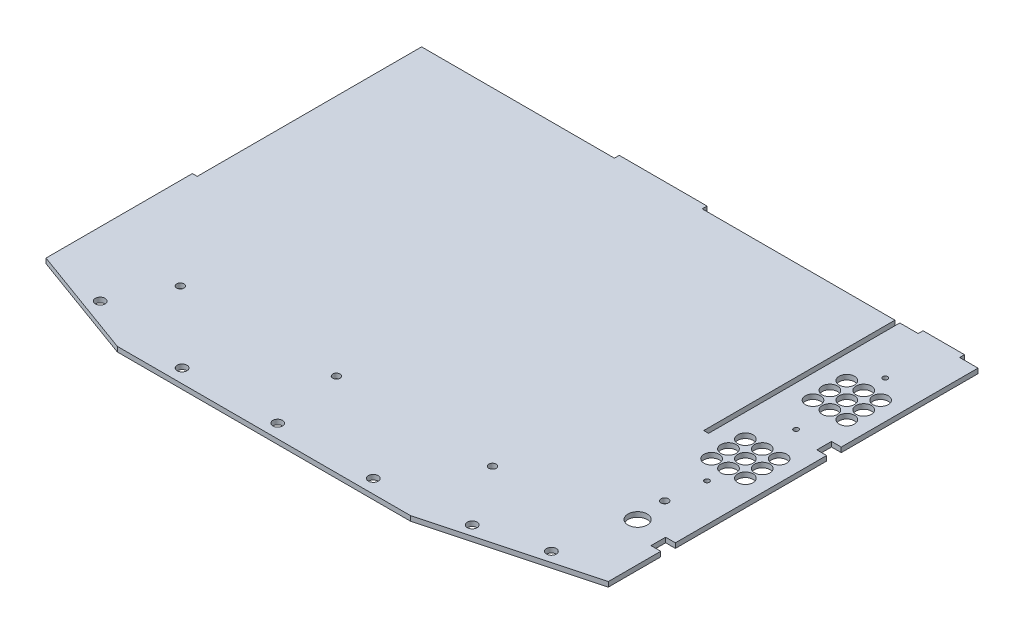
from build123d import *

# Parameters (mm, degrees)
SKETCH1_W            = 308.08168
SKETCH1_H            = 3.175
BOSS_EXTRUDE1_DEPTH  = 267.83
SKETCH3_W            = 267.83
SKETCH3_H            = 3.175
BOSS_EXTRUDE3_DEPTH  = 3.175
SKETCH4_W            = 50.8889
SKETCH4_H            = 3.175
BOSS_EXTRUDE4_DEPTH  = 267.83
CUT_EXTRUDE1_DEPTH   = 340.191055801
SKETCH17_W           = 267.83
SKETCH17_H           = 3.175
BOSS_EXTRUDE5_DEPTH  = 3.175
CUT_EXTRUDE3_DEPTH   = 340.191055801
SKETCH25_R           = 3.175
CUT_EXTRUDE8_DEPTH   = 3.175
SKETCH27_R           = 5
CUT_EXTRUDE9_DEPTH   = 340.191055801
SKETCH31_R           = 1.5875
CUT_EXTRUDE10_DEPTH  = 340.191055801
LPATTERN1_COUNT      = 3
LPATTERN1_PITCH      = 58
M4_CLEARANCE_HOLE1_D = 4.8
SKETCH36_W           = 57.15
SKETCH36_H           = 3.175
SKETCH36_W_2         = 26.9875
BOSS_EXTRUDE6_DEPTH  = 3.175
SKETCH37_W           = 3.175
SKETCH37_H           = 124.4419914
CUT_EXTRUDE11_DEPTH  = 340.191055801
SKETCH38_W           = 3.175
SKETCH38_H           = 146.0243
CUT_EXTRUDE12_DEPTH  = 340.191055801
SKETCH39_W           = 6.35
SKETCH39_H           = 9.525
CUT_EXTRUDE13_DEPTH  = 340.191055801
SKETCH40_R           = 6.25
CUT_EXTRUDE14_DEPTH  = 340.191055801


with BuildPart() as part:
    # Sketch1 → Boss-Extrude1 (new body)
    with BuildSketch(Plane.XY):
        Rectangle(SKETCH1_W, SKETCH1_H)
    extrude(amount=BOSS_EXTRUDE1_DEPTH)

    # Sketch3 → Boss-Extrude3 (add)
    with BuildSketch(Plane(origin=(154.04084, 0, 0), x_dir=(0, 0, -1), z_dir=(1, 0, 0))):
        with Locations((-133.915, 0)):
            Rectangle(SKETCH3_W, SKETCH3_H)
    extrude(amount=BOSS_EXTRUDE3_DEPTH)

    # Sketch4 → Boss-Extrude4 (add)
    with BuildSketch(Plane.XY.offset(267.83)):
        with Locations((182.66029, 0)):
            Rectangle(SKETCH4_W, SKETCH4_H)
    extrude(amount=-BOSS_EXTRUDE4_DEPTH)

    # Sketch6 → Cut-Extrude1 (cut, through all)
    with BuildSketch(Plane(origin=(0, 1.5875, 0), x_dir=(1, 0, 0), z_dir=(0, 1, 0))):
        Polygon((208.10474, -240.606362049), (106.50474, -267.83), (208.10474, -267.83), align=None)
    extrude(amount=-CUT_EXTRUDE1_DEPTH, mode=Mode.SUBTRACT)

    # Sketch17 → Boss-Extrude5 (add)
    with BuildSketch(Plane.ZY.offset(154.04084)):
        with Locations((133.915, 0)):
            Rectangle(SKETCH17_W, SKETCH17_H)
    extrude(amount=BOSS_EXTRUDE5_DEPTH)

    # Sketch11 → Cut-Extrude3 (cut, through all)
    with BuildSketch(Plane.XZ.offset(1.5875)):
        Polygon((-157.21584, 241.2743), (-84.254653892, 267.83), (-157.21584, 267.83), align=None)
    extrude(amount=-CUT_EXTRUDE3_DEPTH, mode=Mode.SUBTRACT)

    # Sketch25 → Cut-Extrude8 (cut)
    with BuildSketch(Plane.XZ.offset(1.5875)):
        with Locations(Location((-115.322188641, 247.921359373, 0), (0, 0, 270))):
            Circle(SKETCH25_R)
        with Locations(Location((-50.97526, 258.94, 0), (0, 0, 270))):
            Circle(SKETCH25_R)
        with Locations(Location((11.25474, 258.94, 0), (0, 0, 270))):
            Circle(SKETCH25_R)
        with Locations(Location((73.48474, 258.94, 0), (0, 0, 270))):
            Circle(SKETCH25_R)
        with Locations(Location((172.54474, 242.09298883, 0), (0, 0, 270))):
            Circle(SKETCH25_R)
        with Locations(Location((131.90474, 252.982444011, 0), (0, 0, 270))):
            Circle(SKETCH25_R)
    extrude(amount=-CUT_EXTRUDE8_DEPTH, mode=Mode.SUBTRACT)

    # Sketch27 → Cut-Extrude9 (cut, through all)
    with BuildSketch(Plane.XZ.offset(1.5875)):
        with Locations(Location((172.48674, 137.774823778, 0), (0, 0, 270))):
            Circle(SKETCH27_R)
        with Locations(Location((183.48674, 137.774823778, 0), (0, 0, 270))):
            Circle(SKETCH27_R)
        with Locations(Location((194.48674, 137.774823778, 0), (0, 0, 270))):
            Circle(SKETCH27_R)
        with Locations(Location((194.48674, 126.774823778, 0), (0, 0, 270))):
            Circle(SKETCH27_R)
        with Locations(Location((194.48674, 115.774823778, 0), (0, 0, 270))):
            Circle(SKETCH27_R)
        with Locations(Location((183.48674, 126.774823778, 0), (0, 0, 270))):
            Circle(SKETCH27_R)
        with Locations(Location((183.48674, 115.774823778, 0), (0, 0, 270))):
            Circle(SKETCH27_R)
        with Locations(Location((172.48674, 115.774823778, 0), (0, 0, 270))):
            Circle(SKETCH27_R)
        with Locations(Location((172.48674, 126.774823778, 0), (0, 0, 270))):
            Circle(SKETCH27_R)
        with Locations(Location((194.48674, 71.774823778, 0), (0, 0, 270))):
            Circle(SKETCH27_R)
        with Locations(Location((194.48674, 60.774823778, 0), (0, 0, 270))):
            Circle(SKETCH27_R)
        with Locations(Location((194.48674, 49.774823778, 0), (0, 0, 270))):
            Circle(SKETCH27_R)
        with Locations(Location((183.48674, 71.774823778, 0), (0, 0, 270))):
            Circle(SKETCH27_R)
        with Locations(Location((183.48674, 60.774823778, 0), (0, 0, 270))):
            Circle(SKETCH27_R)
        with Locations(Location((183.48674, 49.774823778, 0), (0, 0, 270))):
            Circle(SKETCH27_R)
        with Locations(Location((172.48674, 49.774823778, 0), (0, 0, 270))):
            Circle(SKETCH27_R)
        with Locations(Location((172.48674, 60.774823778, 0), (0, 0, 270))):
            Circle(SKETCH27_R)
        with Locations(Location((172.48674, 71.774823778, 0), (0, 0, 270))):
            Circle(SKETCH27_R)
    extrude(amount=-CUT_EXTRUDE9_DEPTH, mode=Mode.SUBTRACT)

    # Sketch31 → Cut-Extrude10 (cut, symmetric)
    with BuildSketch(Plane.XZ.offset(1.5875)):
        with Locations(Location((183.48674, 151.774823778, 0), (0, 0, 270))):
            Circle(SKETCH31_R)
    cut_extrude10 = extrude(amount=CUT_EXTRUDE10_DEPTH, both=True, mode=Mode.SUBTRACT)

    # LPattern1: Cut-Extrude10 ×3
    with Locations(*[(0, 0, -i * LPATTERN1_PITCH) for i in range(1, LPATTERN1_COUNT)]):
        add(cut_extrude10, mode=Mode.SUBTRACT)

    # M4 Clearance Hole1 (through all)
    with Locations(Plane.XZ.offset(1.5875)):
        with Locations((180.96500002, 176.776), (-97.77095, 213.2849914), (3.82905, 213.2849914), (105.42905, 213.2849914)):
            Hole(M4_CLEARANCE_HOLE1_D / 2)

    # Sketch36 → Boss-Extrude6 (add)
    with BuildSketch(Plane(origin=(0, 0, 0), x_dir=(-1, 0, 0), z_dir=(0, 0, -1))):
        Rectangle(SKETCH36_W, SKETCH36_H)
        with Locations((-182.66100002, 0)):
            Rectangle(SKETCH36_W_2, SKETCH36_H)
    extrude(amount=BOSS_EXTRUDE6_DEPTH)

    # Sketch37 → Cut-Extrude11 (cut, through all)
    with BuildSketch(Plane.XZ.offset(1.5875)):
        with Locations((155.62850002, 62.2209957)):
            Rectangle(SKETCH37_W, SKETCH37_H)
    extrude(amount=-CUT_EXTRUDE11_DEPTH, mode=Mode.SUBTRACT)

    # Sketch38 → Cut-Extrude12 (cut, through all)
    with BuildSketch(Plane.XZ.offset(1.5875)):
        with Locations((-155.62834, 73.01215)):
            Rectangle(SKETCH38_W, SKETCH38_H)
    extrude(amount=-CUT_EXTRUDE12_DEPTH, mode=Mode.SUBTRACT)

    # Sketch39 → Cut-Extrude13 (cut, through all)
    with BuildSketch(Plane.XZ.offset(1.5875)):
        with Locations((204.92974, 93.774823778)):
            Rectangle(SKETCH39_W, SKETCH39_H)
        with Locations((204.92974, 201.724823778)):
            Rectangle(SKETCH39_W, SKETCH39_H)
    extrude(amount=-CUT_EXTRUDE13_DEPTH, mode=Mode.SUBTRACT)

    # Sketch40 → Cut-Extrude14 (cut, through all)
    with BuildSketch(Plane.XZ.offset(1.5875)):
        with Locations(Location((182.66100002, 196.101, 0), (0, 0, 270))):
            Circle(SKETCH40_R)
    extrude(amount=-CUT_EXTRUDE14_DEPTH, mode=Mode.SUBTRACT)


solid = part.part
